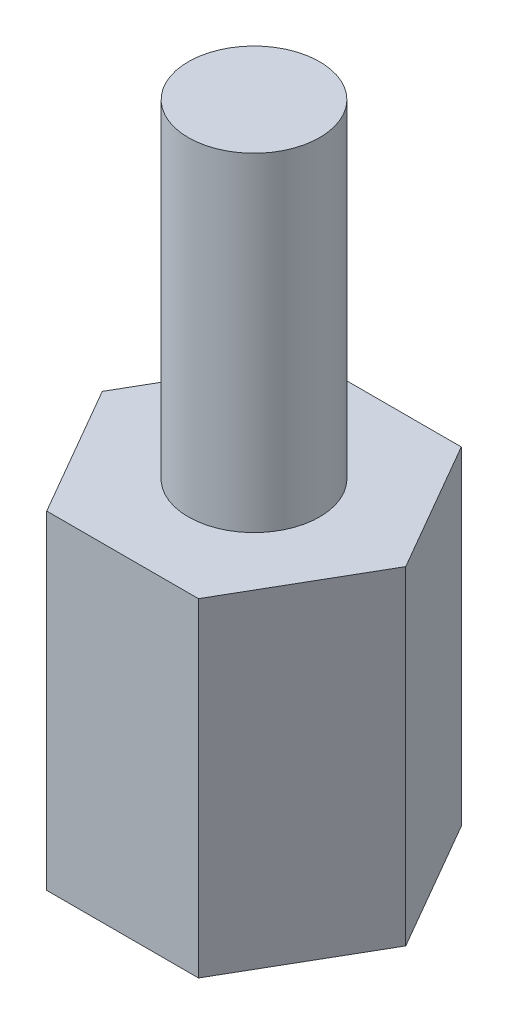
from build123d import *

# Parameters (mm, degrees)
SKETCH1_R           = 1
BOSS_EXTRUDE1_DEPTH = 5
BOSS_EXTRUDE2_DEPTH = 5
SKETCH3_R           = 1
CUT_EXTRUDE1_DEPTH  = 3


with BuildPart() as part:
    # Sketch1 → Boss-Extrude1 (new body)
    with BuildSketch(Plane(origin=(0, 0, 0), x_dir=(1, 0, 0), z_dir=(0, 1, 0))):
        with Locations(Location((0, 0, 0), (0, 0, 270))):
            Circle(SKETCH1_R)
    extrude(amount=BOSS_EXTRUDE1_DEPTH)

    # Sketch2 → Boss-Extrude2 (add)
    with BuildSketch(Plane(origin=(0, 0, 0), x_dir=(1, 0, 0), z_dir=(0, 1, 0))):
        Polygon((2.309401077, 0), (1.154700538, 2), (-1.154700538, 2), (-2.309401077, 0), (-1.154700538, -2), (1.154700538, -2), align=None)
    extrude(amount=-BOSS_EXTRUDE2_DEPTH)

    # Sketch3 → Cut-Extrude1 (cut)
    with BuildSketch(Plane.XZ.offset(5)):
        with Locations(Location((0, 0, 0), (0, 0, 90))):
            Circle(SKETCH3_R)
    extrude(amount=-CUT_EXTRUDE1_DEPTH, mode=Mode.SUBTRACT)


solid = part.part
